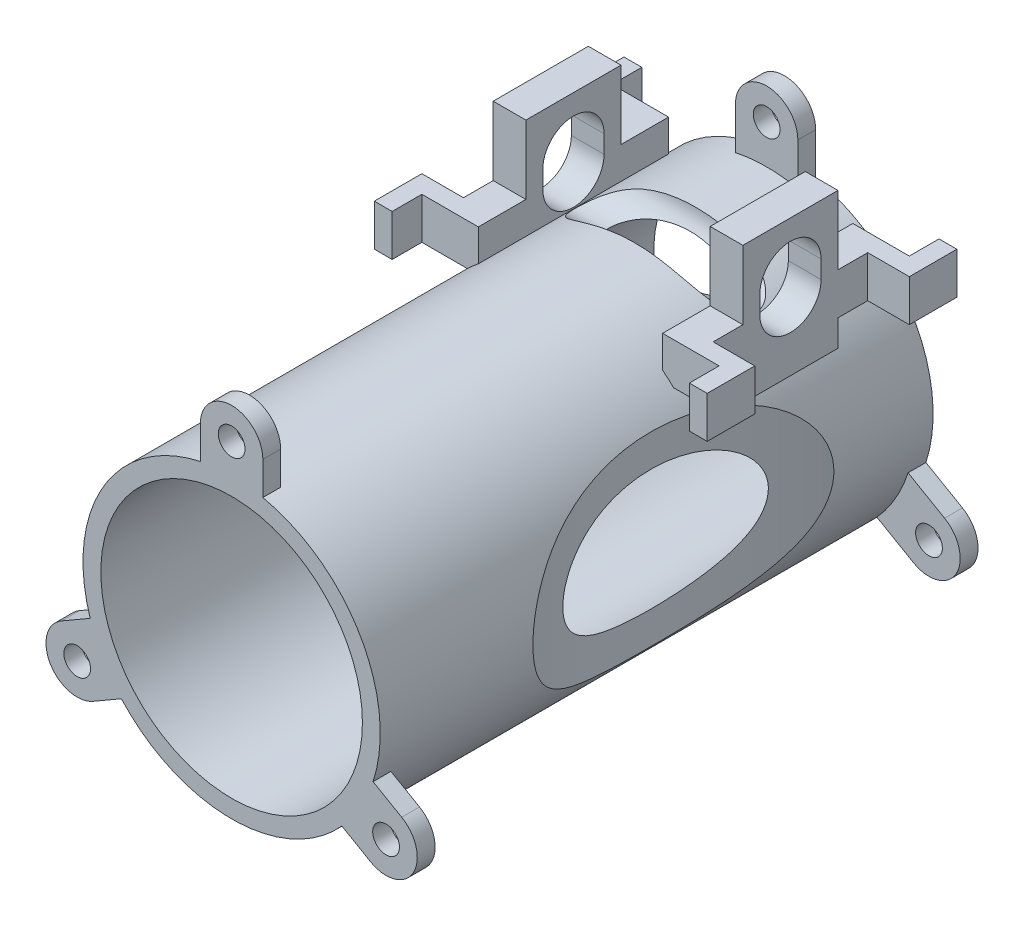
from build123d import *

# Parameters (mm, degrees)
SKETCH1_R                 = 25
SKETCH1_R_2               = 22
BOSS_EXTRUDE1_DEPTH       = 40
SKETCH3_R                 = 5.15
CUT_EXTRUDE1_DEPTH        = 25
SKETCH7_R                 = 25
SKETCH7_R_2               = 22
BOSS_EXTRUDE4_DEPTH       = 53
SKETCH9_R                 = 2.25
BOSS_EXTRUDE5_DEPTH       = 3
CIRPATTERN1_COUNT         = 3
BOSS_EXTRUDE6_START       = -3
SKETCH10_R                = 2.25
BOSS_EXTRUDE6_DEPTH       = 3
CIRPATTERN2_COUNT         = 3
BOSS_EXTRUDE7_DEPTH       = 8
CUT_EXTRUDE5_START        = -16
CUT_EXTRUDE5_DEPTH        = 16
SKETCH17_W                = 3
SKETCH17_H                = 5
SKETCH17_W_2              = 5.5
BOSS_EXTRUDE8_DEPTH       = 7
MIRROR2_COPY_1_SKETCH_W   = 3
MIRROR2_COPY_1_SKETCH_H   = 5
MIRROR2_COPY_1_SKETCH_W_2 = 5.5
MIRROR2_COPY_1_DEPTH      = 7
CUT_EXTRUDE4_DEPTH        = 6
CUT_EXTRUDE4_DEPTH_BACK   = 41
SKETCH12_R                = 61


with BuildPart() as part:
    # Sketch1 → Boss-Extrude1 (new body)
    with BuildSketch(Plane.XY):
        Circle(SKETCH1_R)
        Circle(SKETCH1_R_2, mode=Mode.SUBTRACT)
    extrude(amount=BOSS_EXTRUDE1_DEPTH)

    # Sketch3 → Cut-Extrude1 (cut, symmetric)
    with BuildSketch(Plane(origin=(0, 0, 0), x_dir=(0, 0, -1), z_dir=(1, 0, 0))):
        with Locations((-20, 25)):
            Circle(SKETCH3_R)
    extrude(amount=CUT_EXTRUDE1_DEPTH, both=True, mode=Mode.SUBTRACT)

    # Sketch7 → Boss-Extrude4 (add)
    with BuildSketch(Plane.XY.offset(40)):
        Circle(SKETCH7_R)
        Circle(SKETCH7_R_2, mode=Mode.SUBTRACT)
    extrude(amount=BOSS_EXTRUDE4_DEPTH)

    # Sketch9 → Boss-Extrude5 (add)
    with BuildSketch(Plane(origin=(0, 0, 0), x_dir=(-1, 0, 0), z_dir=(0, 0, -1))):
        with BuildLine():
            Line((5.25, 24.442534648), (5.25, 31.532998323))
            ThreePointArc((5.25, 31.532998323), (0, 36.782998323), (-5.25, 31.532998323))
            Line((-5.25, 31.532998323), (-5.25, 24.442534648))
            ThreePointArc((-5.25, 24.442534648), (0, 25), (5.25, 24.442534648))
        make_face()
        with Locations((0, 31.532998323)):
            Circle(SKETCH9_R, mode=Mode.SUBTRACT)
    boss_extrude5 = extrude(amount=-BOSS_EXTRUDE5_DEPTH)

    # CirPattern1: Boss-Extrude5 ×3 about axis
    cirpattern1_axis = Axis((0, 0, 0), (0, 0, 1))
    for i in range(1, CIRPATTERN1_COUNT):
        add(boss_extrude5.rotate(cirpattern1_axis, i * 360 / CIRPATTERN1_COUNT))

    # Sketch10 → Boss-Extrude6 (add)
    with BuildSketch(Plane.XY.offset(93).offset(BOSS_EXTRUDE6_START)):
        with BuildLine():
            ThreePointArc((-5.25, 24.442534648), (0, 25), (5.25, 24.442534648))
            Line((5.25, 24.442534648), (5.25, 30))
            ThreePointArc((5.25, 30), (0, 35.25), (-5.25, 30))
            Line((-5.25, 30), (-5.25, 24.442534648))
        make_face()
        with Locations((0, 30)):
            Circle(SKETCH10_R, mode=Mode.SUBTRACT)
    boss_extrude6 = extrude(amount=BOSS_EXTRUDE6_DEPTH)

    # CirPattern2: Boss-Extrude6 ×3 about axis
    cirpattern2_axis = Axis((0, 0, 0), (0, 0, 1))
    for i in range(1, CIRPATTERN2_COUNT):
        add(boss_extrude6.rotate(cirpattern2_axis, i * 360 / CIRPATTERN2_COUNT))

    # Sketch14 → Boss-Extrude7 (add, symmetric)
    with BuildSketch(Plane.XY.offset(20)):
        with BuildLine():
            Line((-21, 13.564659966), (-21, 36.564659966))
            Line((-21, 36.564659966), (-15.5, 36.564659966))
            Line((-15.5, 36.564659966), (-15.5, 19.615045246))
            ThreePointArc((-15.5, 19.615045246), (-18.499034853, 16.816233511), (-21, 13.564659966))
        make_face()
    boss_extrude7 = extrude(amount=BOSS_EXTRUDE7_DEPTH, both=True)

    # Sketch15 → Cut-Extrude5 (cut)
    with BuildSketch(Plane.ZY.offset(21).offset(CUT_EXTRUDE5_START)):
        with BuildLine():
            Line((14.85, 25), (14.85, 28))
            ThreePointArc((14.85, 28), (20, 33.15), (25.15, 28))
            Line((25.15, 28), (25.15, 25))
            ThreePointArc((25.15, 25), (20, 19.85), (14.85, 25))
        make_face()
    cut_extrude5 = extrude(amount=CUT_EXTRUDE5_DEPTH, mode=Mode.SUBTRACT)

    # Sketch17 → Boss-Extrude8 (add)
    with BuildSketch(Plane(origin=(0, 25, 0), x_dir=(1, 0, 0), z_dir=(0, 1, 0))):
        with Locations((-26.5, -38.5)):
            Rectangle(SKETCH17_W, SKETCH17_H)
        Polygon((-15.5, -36), (-15.5, -33), (-21, -33), (-28, -33), (-28, -36), (-25, -36), align=None)
        with Locations((-18.25, -30.5)):
            Rectangle(SKETCH17_W_2, SKETCH17_H)
    boss_extrude8 = extrude(amount=-BOSS_EXTRUDE8_DEPTH)

    # Mirror1: Boss-Extrude8 across plane
    add(boss_extrude8.mirror(Plane.XY.offset(20)))

    # Mirror2: Boss-Extrude7, Cut-Extrude5, Boss-Extrude8 across plane
    add(boss_extrude7.mirror(Plane(origin=(0, 0, 0), x_dir=(0, 0, 1), z_dir=(1, 0, 0))))
    add(cut_extrude5.mirror(Plane(origin=(0, 0, 0), x_dir=(0, 0, 1), z_dir=(1, 0, 0))), mode=Mode.SUBTRACT)
    add(boss_extrude8.mirror(Plane(origin=(0, 0, 0), x_dir=(0, 0, 1), z_dir=(1, 0, 0))))

    # Mirror2 copy 1 sketch → Mirror2 copy 1 (add)
    with BuildSketch(Plane(origin=(0, 25, 40), x_dir=(-1, 0, 0), z_dir=(0, 1, 0))):
        with Locations((-26.5, -38.5)):
            Rectangle(MIRROR2_COPY_1_SKETCH_W, MIRROR2_COPY_1_SKETCH_H)
        Polygon((-15.5, -36), (-15.5, -33), (-21, -33), (-28, -33), (-28, -36), (-25, -36), align=None)
        with Locations((-18.25, -30.5)):
            Rectangle(MIRROR2_COPY_1_SKETCH_W_2, MIRROR2_COPY_1_SKETCH_H)
    extrude(amount=-MIRROR2_COPY_1_DEPTH)

    # Sketch12 → Cut-Extrude4 (cut, two sides: drawn at the far end of the back side and taken through both)
    with BuildSketch(Plane(origin=(0, 11.51, 0), x_dir=(1, 0, 0), z_dir=(0, 1, 0)).offset(-CUT_EXTRUDE4_DEPTH_BACK)):
        with Locations((-80.5, -42)):
            Circle(SKETCH12_R)
        with Locations((80.5, -42)):
            Circle(SKETCH12_R)
    extrude(amount=CUT_EXTRUDE4_DEPTH + CUT_EXTRUDE4_DEPTH_BACK, mode=Mode.SUBTRACT)


solid = part.part
